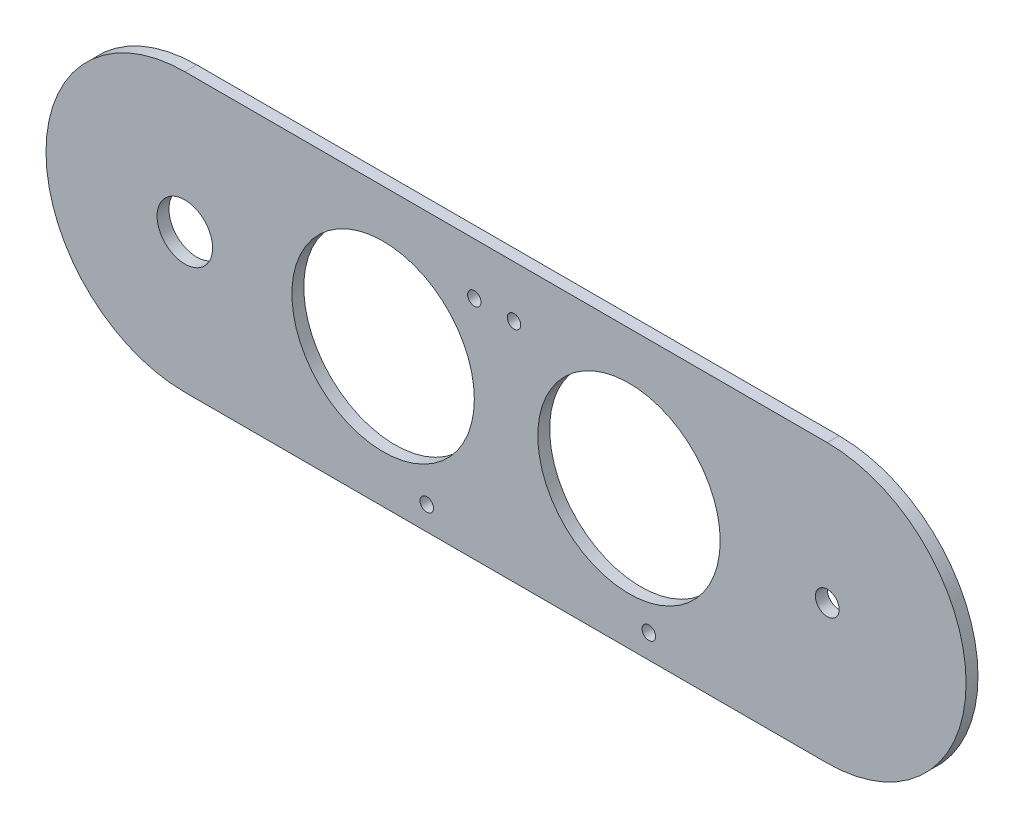
from build123d import *

# Parameters (mm, degrees)
ESQUISSE2_R                = 7
ESQUISSE2_R_2              = 3
ESQUISSE2_R_3              = 23
BASE_EXTRUSION_DEPTH       = 3
ESQUISSE9_R                = 1.7
ENL_V_MAT_EXTRU_2_DEPTH    = 146.332674598
R_P_TITION_LIN_AIRE1_COUNT = 2
R_P_TITION_LIN_AIRE1_PITCH = 10
ESQUISSE10_R               = 1.7
ENL_V_MAT_EXTRU_3_DEPTH    = 146.332674598
R_P_TITION_LIN_AIRE2_COUNT = 2
R_P_TITION_LIN_AIRE2_PITCH = 56


with BuildPart() as part:
    # Esquisse2 → Base-Extrusion (new body)
    with BuildSketch(Plane.XY):
        with BuildLine():
            Line((-60.587831126, 50.043046358), (101.412168874, 50.043046358))
            ThreePointArc((101.412168874, 50.043046358), (136.412168874, 15.043046358), (101.412168874, -19.956953642))
            Line((101.412168874, -19.956953642), (-60.587831126, -19.956953642))
            ThreePointArc((-60.587831126, -19.956953642), (-95.587831126, 15.043046358), (-60.587831126, 50.043046358))
        make_face()
        with Locations((-60.587831126, 15.043046358)):
            Circle(ESQUISSE2_R, mode=Mode.SUBTRACT)
        with Locations((101.412168874, 15.043046358)):
            Circle(ESQUISSE2_R_2, mode=Mode.SUBTRACT)
        with Locations((51.412168874, 15.043046358)):
            Circle(ESQUISSE2_R_3, mode=Mode.SUBTRACT)
        with Locations((-10.587831126, 15.043046358)):
            Circle(ESQUISSE2_R_3, mode=Mode.SUBTRACT)
    extrude(amount=BASE_EXTRUSION_DEPTH)

    # Esquisse9 → Enlèv. mat.-Extru.2 (cut, through all)
    with BuildSketch(Plane.XY.offset(3)):
        with Locations((12.412168874, 37.043046358)):
            Circle(ESQUISSE9_R)
    enl_v_mat_extru_2 = extrude(amount=-ENL_V_MAT_EXTRU_2_DEPTH, mode=Mode.SUBTRACT)

    # Répétition linéaire1: Enlèv. mat.-Extru.2 ×2
    with Locations(*[(i * R_P_TITION_LIN_AIRE1_PITCH, 0, 0) for i in range(1, R_P_TITION_LIN_AIRE1_COUNT)]):
        add(enl_v_mat_extru_2, mode=Mode.SUBTRACT)

    # Esquisse10 → Enlèv. mat.-Extru.3 (cut, through all)
    with BuildSketch(Plane.XY.offset(3)):
        with Locations((0.412168874, -13.956953642)):
            Circle(ESQUISSE10_R)
    enl_v_mat_extru_3 = extrude(amount=-ENL_V_MAT_EXTRU_3_DEPTH, mode=Mode.SUBTRACT)

    # Répétition linéaire2: Enlèv. mat.-Extru.3 ×2
    with Locations(*[(i * R_P_TITION_LIN_AIRE2_PITCH, 0, 0) for i in range(1, R_P_TITION_LIN_AIRE2_COUNT)]):
        add(enl_v_mat_extru_3, mode=Mode.SUBTRACT)


solid = part.part
